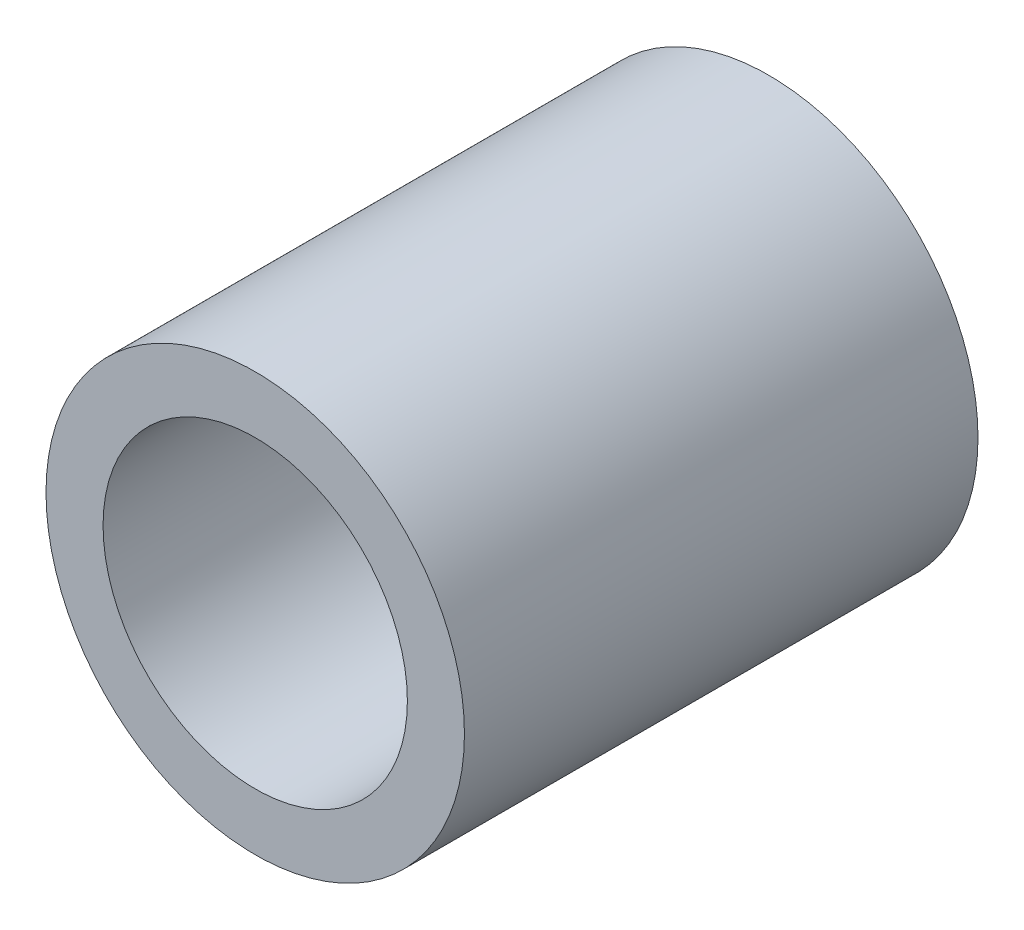
from build123d import *

# Parameters (mm, degrees)
CROQUIS1_R              = 11
CROQUIS1_R_2            = 8
SALIENTE_EXTRUIR1_DEPTH = 27


with BuildPart() as part:
    # Croquis1 → Saliente-Extruir1 (new body)
    with BuildSketch(Plane.XY):
        Circle(CROQUIS1_R)
        Circle(CROQUIS1_R_2, mode=Mode.SUBTRACT)
    extrude(amount=-SALIENTE_EXTRUIR1_DEPTH)


solid = part.part
